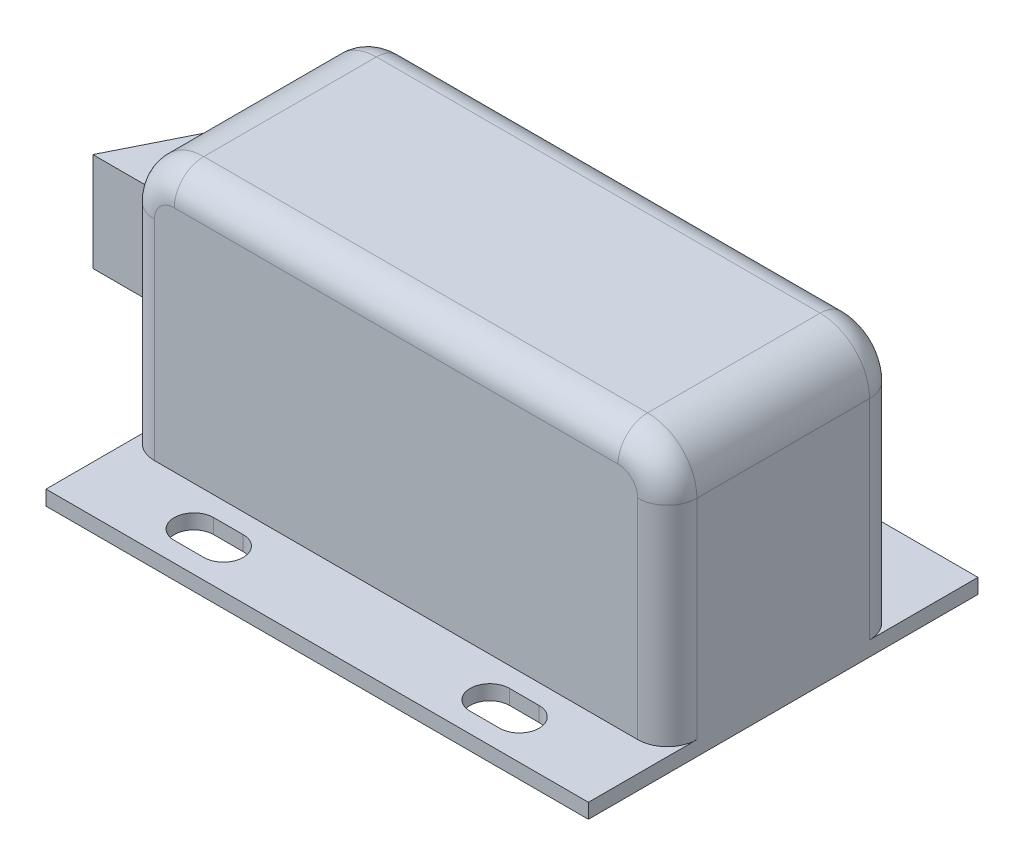
from build123d import *

# Parameters (mm, degrees)
SKETCH1_W           = 55
SKETCH1_H           = 39.5
BOSS_EXTRUDE1_DEPTH = 27.7
SKETCH2_W           = 8
SKETCH2_H           = 26.2
CUT_EXTRUDE1_DEPTH  = 65.877365082
SKETCH3_W           = 8
SKETCH3_H           = 26.2
CUT_EXTRUDE2_DEPTH  = 65.877365082
CUT_EXTRUDE3_DEPTH  = 50.345111207
CUT_EXTRUDE4_DEPTH  = 51.15765146
CUT_EXTRUDE5_DEPTH  = 50.345111207
CUT_EXTRUDE6_DEPTH  = 51.15765146
BOSS_EXTRUDE2_DEPTH = 10
FILLET1_R           = 5
FILLET2_R           = 3


with BuildPart() as part:
    # Sketch1 → Boss-Extrude1 (new body)
    with BuildSketch(Plane(origin=(0, 13.85, 0), x_dir=(1, 0, 0), z_dir=(0, 1, 0))):
        with Locations((0, -11.75)):
            Rectangle(SKETCH1_W, SKETCH1_H)
    extrude(amount=-BOSS_EXTRUDE1_DEPTH)

    # Sketch2 → Cut-Extrude1 (cut, through all)
    with BuildSketch(Plane.ZY.offset(27.5)):
        with Locations((27.5, 0.75)):
            Rectangle(SKETCH2_W, SKETCH2_H)
    extrude(amount=-CUT_EXTRUDE1_DEPTH, mode=Mode.SUBTRACT)

    # Sketch3 → Cut-Extrude2 (cut, through all)
    with BuildSketch(Plane.ZY.offset(27.5)):
        with Locations((-4, 0.75)):
            Rectangle(SKETCH3_W, SKETCH3_H)
    extrude(amount=-CUT_EXTRUDE2_DEPTH, mode=Mode.SUBTRACT)

    # Sketch4 → Cut-Extrude3 (cut, through all)
    with BuildSketch(Plane(origin=(0, -12.35, 0), x_dir=(-1, 0, 0), z_dir=(0, 1, 0))):
        with BuildLine():
            Line((-13.5, -2), (-16.5, -2))
            ThreePointArc((-16.5, -2), (-18.5, -4), (-16.5, -6))
            Line((-16.5, -6), (-13.5, -6))
            ThreePointArc((-13.5, -6), (-11.5, -4), (-13.5, -2))
        make_face()
    extrude(amount=-CUT_EXTRUDE3_DEPTH, mode=Mode.SUBTRACT)

    # Sketch5 → Cut-Extrude4 (cut, through all)
    with BuildSketch(Plane.XZ.offset(13.85)):
        with BuildLine():
            Line((-16.5, -6), (-13.5, -6))
            ThreePointArc((-13.5, -6), (-11.5, -4), (-13.5, -2))
            Line((-13.5, -2), (-16.5, -2))
            ThreePointArc((-16.5, -2), (-18.5, -4), (-16.5, -6))
        make_face()
    extrude(amount=-CUT_EXTRUDE4_DEPTH, mode=Mode.SUBTRACT)

    # Sketch6 → Cut-Extrude5 (cut, through all)
    with BuildSketch(Plane(origin=(0, -12.35, 0), x_dir=(-1, 0, 0), z_dir=(0, 1, 0))):
        with BuildLine():
            Line((16.5, 29.5), (13.5, 29.5))
            ThreePointArc((13.5, 29.5), (11.5, 27.5), (13.5, 25.5))
            Line((13.5, 25.5), (16.5, 25.5))
            ThreePointArc((16.5, 25.5), (18.5, 27.5), (16.5, 29.5))
        make_face()
    extrude(amount=-CUT_EXTRUDE5_DEPTH, mode=Mode.SUBTRACT)

    # Sketch7 → Cut-Extrude6 (cut, through all)
    with BuildSketch(Plane.XZ.offset(13.85)):
        with BuildLine():
            Line((13.5, 25.5), (16.5, 25.5))
            ThreePointArc((16.5, 25.5), (18.5, 27.5), (16.5, 29.5))
            Line((16.5, 29.5), (13.5, 29.5))
            ThreePointArc((13.5, 29.5), (11.5, 27.5), (13.5, 25.5))
        make_face()
    extrude(amount=-CUT_EXTRUDE6_DEPTH, mode=Mode.SUBTRACT)

    # Sketch8 → Boss-Extrude2 (add)
    with BuildSketch(Plane.XZ.offset(5.35)):
        Polygon((-37.5, 16.75), (-32.5, 6.75), (-27.5, 6.75), (-27.5, 16.75), align=None)
    extrude(amount=-BOSS_EXTRUDE2_DEPTH)

    # Fillet1
    fillet1_edges = [part.edges().sort_by_distance(p)[0] for p in [
        (27.5, 13.85, 11.75),
        (-27.5, 13.85, 11.75),
    ]]
    fillet(fillet1_edges, radius=FILLET1_R)

    # Fillet2
    fillet2_edges = [part.edges().sort_by_distance(p)[0] for p in [
        (0, 13.85, 0),
        (0, 13.85, 23.5),
        (-26.035533906, 12.385533906, 0),
        (26.035533906, 12.385533906, 0),
        (27.5, -1.75, 23.5),
        (-27.5, -1.75, 23.5),
        (-26.035533906, 12.385533906, 23.5),
        (26.035533906, 12.385533906, 23.5),
        (27.5, -1.75, 0),
        (-27.5, -1.75, 0),
    ]]
    fillet(fillet2_edges, radius=FILLET2_R)


solid = part.part
